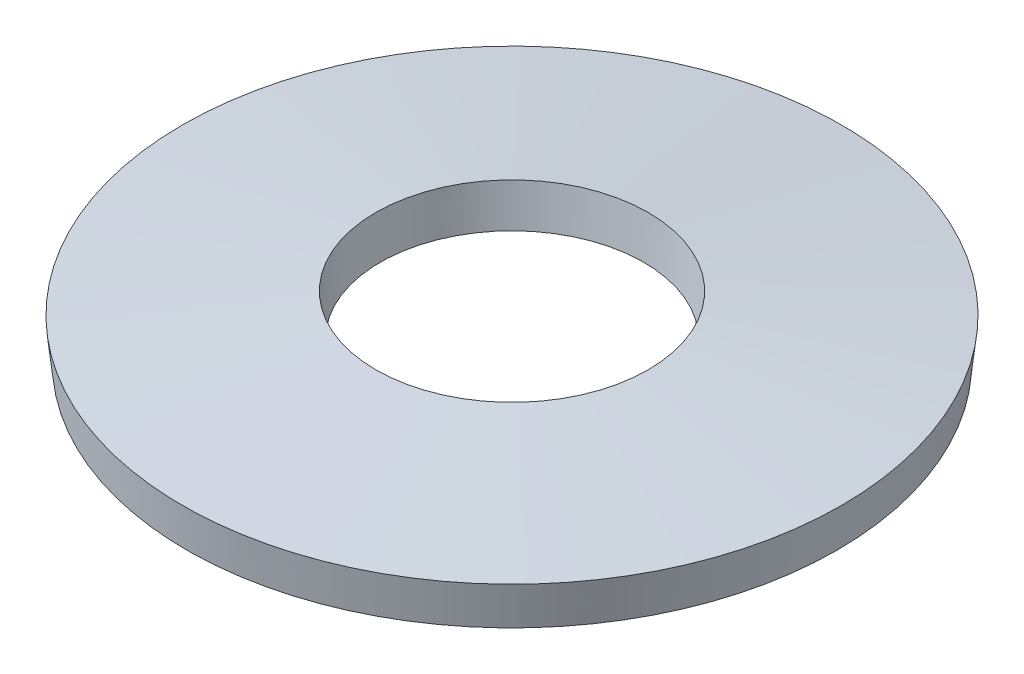
from build123d import *


with BuildPart() as part:
    # Sketch1 → Revolve1 (revolve)
    with BuildSketch(Plane.XY):
        Polygon((3.946424278, 0), (4, 0.497121355), (1.653575722, 0.75), (1.6, 0.252878645), align=None)
    revolve(axis=Axis((0, -0.927331794, 0), (0, 1, 0)))


solid = part.part
